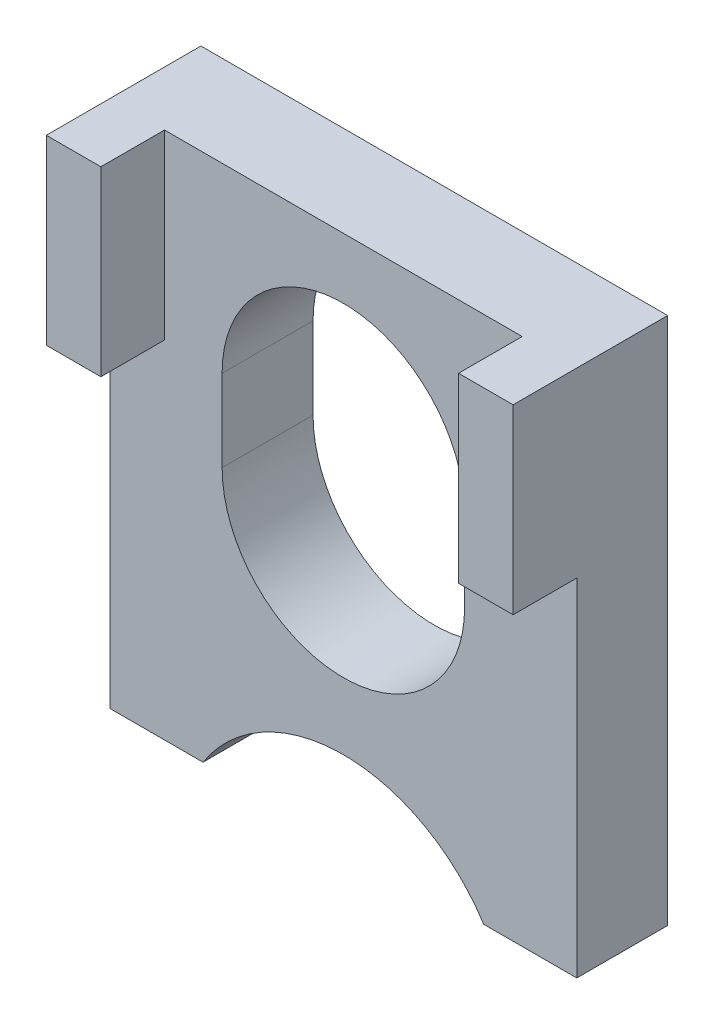
from build123d import *

# Parameters (mm, degrees)
EXTRUDE_1_DEPTH = 3
SKETCH_2_W      = 1.8
SKETCH_2_H      = 6
EXTRUDE_2_DEPTH = 2.1


with BuildPart() as part:
    # Эскиз1 → Бобышка-Вытянуть1 (new body)
    with BuildSketch(Plane.XY):
        with BuildLine():
            Line((-7.7, 13.737499607), (7.7, 13.737499607))
            Line((7.7, 13.737499607), (7.7, -0.039604792))
            Line((7.7, -0.039604792), (7.7, -3.689904326))
            Line((7.7, -3.689904326), (4.629752886, -3.689904326))
            ThreePointArc((4.629752886, -3.689904326), (0, -1.158976271), (-4.629752886, -3.689904326))
            Line((-4.629752886, -3.689904326), (-7.7, -3.689904326))
            Line((-7.7, -3.689904326), (-7.7, -0.039604792))
            Line((-7.7, -0.039604792), (-7.7, 13.737499607))
        make_face()
        with BuildLine():
            Line((4, 7.737499607), (4, 5.041023729))
            ThreePointArc((4, 5.041023729), (0, 1.041023729), (-4, 5.041023729))
            Line((-4, 5.041023729), (-4, 7.737499607))
            ThreePointArc((-4, 7.737499607), (0, 11.737499607), (4, 7.737499607))
        make_face(mode=Mode.SUBTRACT)
    extrude(amount=EXTRUDE_1_DEPTH)

    # Эскиз2 → Бобышка-Вытянуть2 (add)
    with BuildSketch(Plane.XY.offset(3)):
        with Locations((-6.8, 10.737499607)):
            Rectangle(SKETCH_2_W, SKETCH_2_H)
        with Locations((6.8, 10.737499607)):
            Rectangle(SKETCH_2_W, SKETCH_2_H)
    extrude(amount=EXTRUDE_2_DEPTH)


solid = part.part
